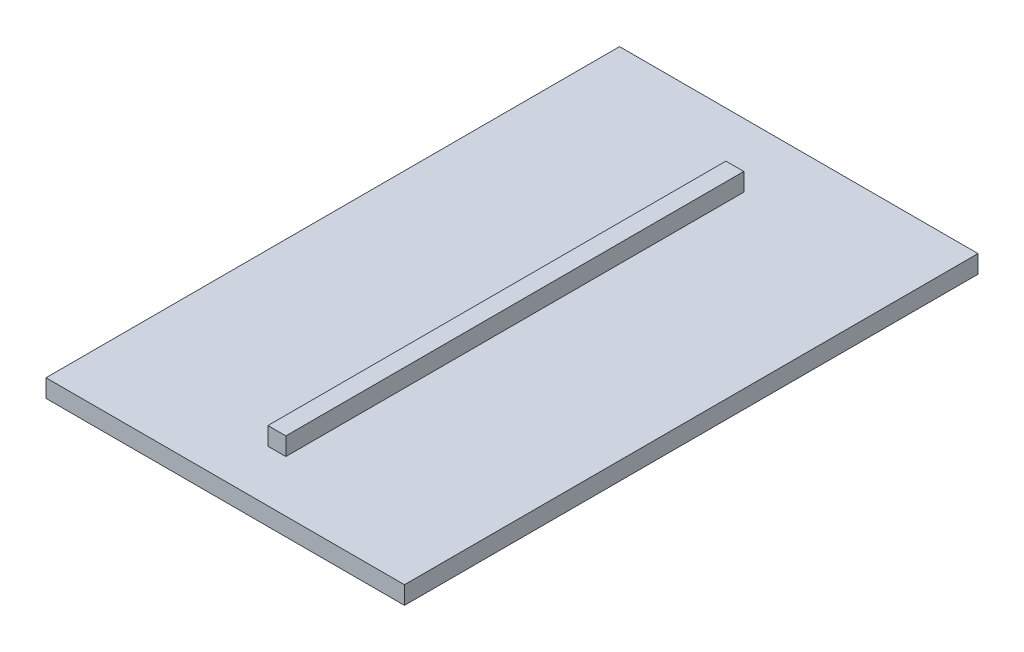
from build123d import *

# Parameters (mm, degrees)
SKETCH1_W           = 10
SKETCH1_H           = 16
BOSS_EXTRUDE1_DEPTH = 0.5
SKETCH3_W           = 0.5
SKETCH3_H           = 12.776417552
BOSS_EXTRUDE2_DEPTH = 0.5


with BuildPart() as part:
    # Sketch1 → Boss-Extrude1 (new body)
    with BuildSketch(Plane(origin=(0, 0, 0), x_dir=(1, 0, 0), z_dir=(0, 1, 0))):
        Rectangle(SKETCH1_W, SKETCH1_H)
    extrude(amount=BOSS_EXTRUDE1_DEPTH)

    # Sketch3 → Boss-Extrude2 (add)
    with BuildSketch(Plane(origin=(0, 0.5, 0), x_dir=(1, 0, 0), z_dir=(0, 1, 0))):
        with Locations((0, -0.170925653)):
            Rectangle(SKETCH3_W, SKETCH3_H)
    extrude(amount=BOSS_EXTRUDE2_DEPTH)


solid = part.part
